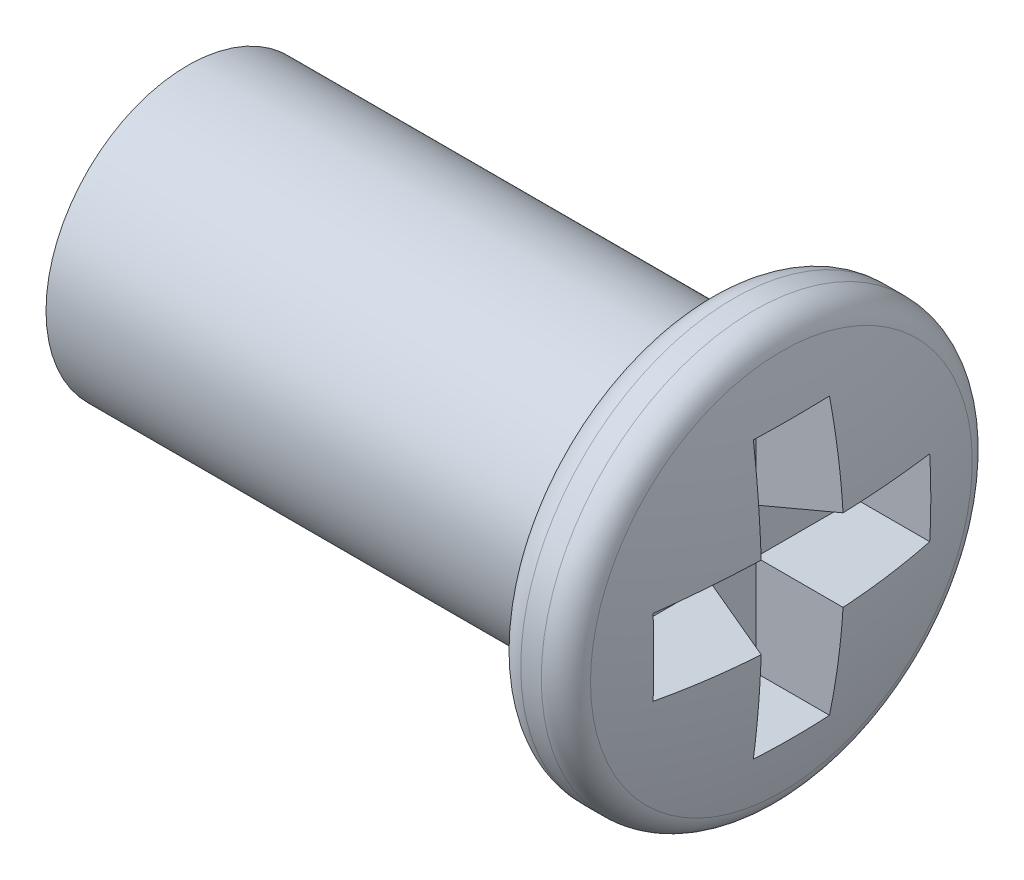
from build123d import *

# Parameters (mm, degrees)
FILLET1_R          = 0.2
CUT_EXTRUDE1_DEPTH = 0.5
CUT_EXTRUDE1_DRAFT = -15


with BuildPart() as part:
    # Sketch1 → Revolve1 (revolve)
    with BuildSketch(Plane.XY, mode=Mode.PRIVATE) as revolve1_sk:
        with BuildLine():
            Line((0, 0), (4.35, 0))
            ThreePointArc((4.35, 0), (4.299779731, 0.756637298), (4.15, 1.5))
            Line((4.15, 1.5), (3.65, 1.5))
            Line((3.65, 1.5), (3.65, 1))
            Line((3.65, 1), (0, 1))
            Line((0, 1), (0, 0))
        make_face()
    revolve(revolve1_sk.sketch.rotate(Axis((-102.03816923, 0, 0), (1, 0, 0)), 90), axis=Axis((-102.03816923, 0, 0), (1, 0, 0)))

    # Fillet1
    fillet1_edges = [part.edges().sort_by_distance(p)[0] for p in [
        (3.65, 0, -1.5),
        (4.15, 0, -1.5),
    ]]
    fillet(fillet1_edges, radius=FILLET1_R)


with BuildPart() as cut_extrude1_tool:
    # Sketch2 → Cut-Extrude1 (with draft: the straight prism first)
    with BuildSketch(Plane(origin=(4.35, 0, 0), x_dir=(0, 0, -1), z_dir=(1, 0, 0))):
        Polygon((0.29273093, 1), (-0.29273093, 1), (-0.29273093, 0.29273093), (-1, 0.29273093), (-1, -0.29273093), (-0.29273093, -0.29273093), (-0.29273093, -1), (0.29273093, -1), (0.29273093, -0.29273093), (1, -0.29273093), (1, 0.29273093), (0.29273093, 0.29273093), align=None)
    extrude(amount=-CUT_EXTRUDE1_DEPTH)
    # Cut-Extrude1: the draft: its side faces are tilted about the plane it starts from
    cut_extrude1_sides = [cut_extrude1_tool.faces().sort_by_distance(p)[0] for p in [
        (4.1, 1, 0),
        (4.1, 0.646365465, 0.29273093),
        (4.1, 0.29273093, 0.646365465),
        (4.1, 0, 1),
        (4.1, -0.29273093, 0.646365465),
        (4.1, -0.646365465, 0.29273093),
        (4.1, -1, 0),
        (4.1, -0.646365465, -0.29273093),
        (4.1, -0.29273093, -0.646365465),
        (4.1, 0, -1),
        (4.1, 0.29273093, -0.646365465),
        (4.1, 0.646365465, -0.29273093),
    ]]
    draft(cut_extrude1_sides, Plane(origin=(4.35, 0, 0), x_dir=(0, 0, -1), z_dir=(1, 0, 0)), CUT_EXTRUDE1_DRAFT)


with BuildPart() as part_1:
    add(part.part)

    # Cut-Extrude1: cut by cut_extrude1_tool
    add(cut_extrude1_tool.part, mode=Mode.SUBTRACT)


solid = part_1.part
